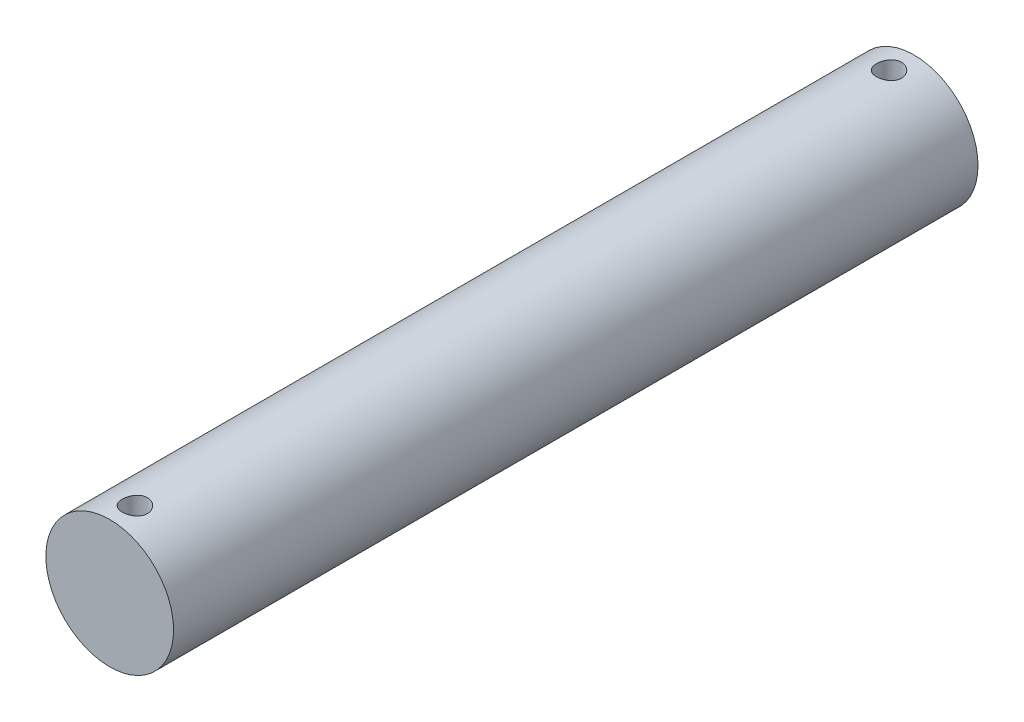
from build123d import *

# Parameters (mm, degrees)
SKETCH1_R           = 6.35
BOSS_EXTRUDE1_DEPTH = 40
SKETCH2_R           = 1.25
CUT_EXTRUDE1_DEPTH  = 25


with BuildPart() as part:
    # Sketch1 → Boss-Extrude1 (new, symmetric)
    with BuildSketch(Plane.XY):
        Circle(SKETCH1_R)
    extrude(amount=BOSS_EXTRUDE1_DEPTH, both=True)

    # Sketch2 → Cut-Extrude1 (cut, symmetric)
    with BuildSketch(Plane(origin=(0, 0, 0), x_dir=(1, 0, 0), z_dir=(0, 1, 0))):
        with Locations(Location((0, 37.5, 0), (0, 0, 270))):
            Circle(SKETCH2_R)
        with Locations(Location((0, -37.5, 0), (0, 0, 270))):
            Circle(SKETCH2_R)
    extrude(amount=CUT_EXTRUDE1_DEPTH, both=True, mode=Mode.SUBTRACT)


solid = part.part
